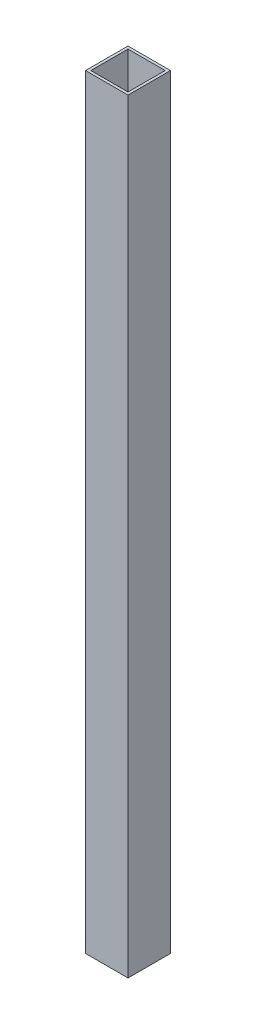
from build123d import *

# Parameters (mm, degrees)
SKETCH1_W           = 25.4
SKETCH1_H           = 25.4
SKETCH1_W_2         = 22.225
SKETCH1_H_2         = 22.225
BOSS_EXTRUDE1_DEPTH = 457.2


with BuildPart() as part:
    # Sketch1 → Boss-Extrude1 (new body)
    with BuildSketch(Plane(origin=(0, 0, 0), x_dir=(1, 0, 0), z_dir=(0, 1, 0))):
        Rectangle(SKETCH1_W, SKETCH1_H)
        Rectangle(SKETCH1_W_2, SKETCH1_H_2, mode=Mode.SUBTRACT)
    extrude(amount=BOSS_EXTRUDE1_DEPTH)


solid = part.part
